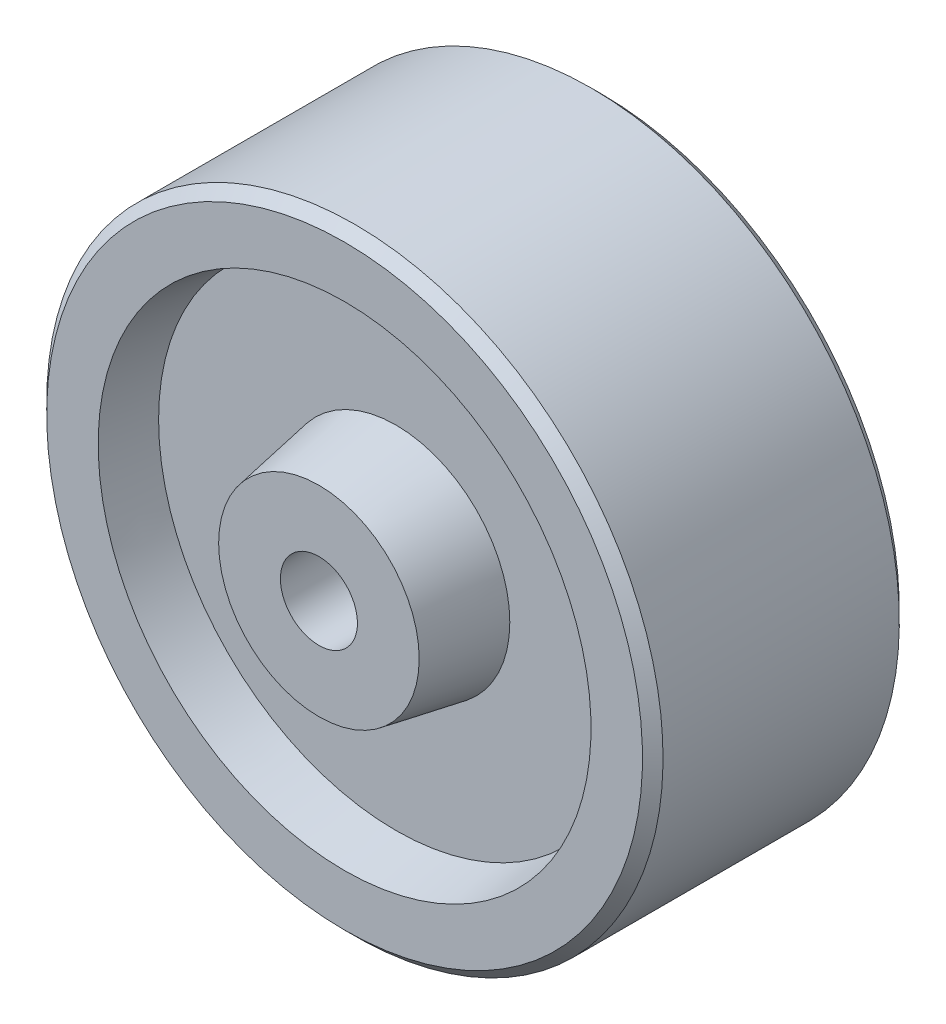
from build123d import *

# Parameters (mm, degrees)
CHAMFER1_SIZE = 1.27


with BuildPart() as part:
    # Sketch2 → Revolve1 (revolve)
    with BuildSketch(Plane(origin=(0, 0, 0), x_dir=(0, 0, -1), z_dir=(1, 0, 0)), mode=Mode.PRIVATE) as revolve1_sk:
        Polygon((0, 38.1), (-15.875, 38.1), (-15.875, 30.465422705), (-9.525, 29.345746377), (-9.525, 21.711169082), (-9.525, 14.076591787), (-19.05, 12.397077295), (-19.05, 4.7625), (0, 4.7625), align=None)
    revolve(revolve1_sk.sketch.rotate(Axis((0, 0, 19.05), (0, 0, -1)), 180), axis=Axis((0, 0, 19.05), (0, 0, -1)))

    # Chamfer1
    chamfer1_edges = [part.edges().sort_by_distance(p)[0] for p in [
        (0, 38.1, 15.875),
    ]]
    chamfer(chamfer1_edges, length=CHAMFER1_SIZE)

    # Mirror2: part across plane


with BuildPart() as part_1:
    add(part.part)
    add(part.part.mirror(Plane.XY))


solid = part_1.part
